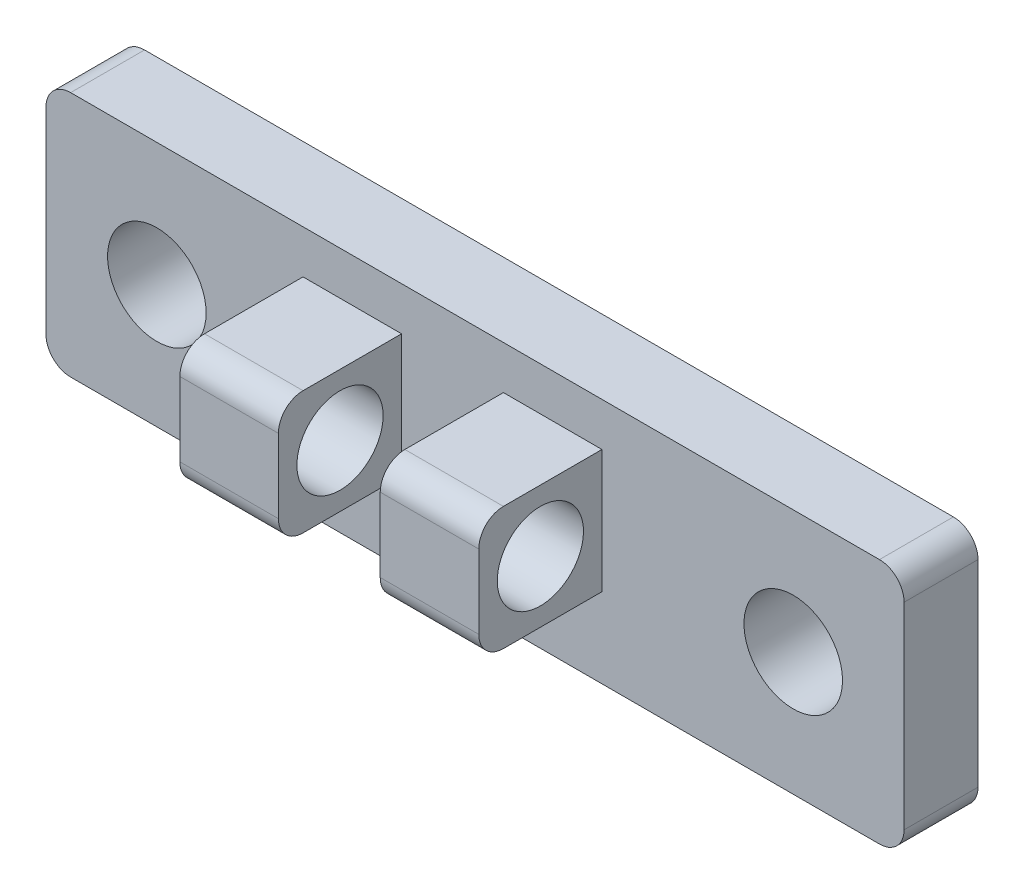
from build123d import *

# Parameters (mm, degrees)
BOSS_EXTRUDE1_DEPTH = 3
SKETCH2_W           = 4
SKETCH2_H           = 5
BOSS_EXTRUDE2_DEPTH = 5
SKETCH3_R           = 1.75
CUT_EXTRUDE1_DEPTH  = 14
FILLET1_R           = 1
SKETCH5_R           = 2
CUT_EXTRUDE2_DEPTH  = 5
SKETCH7_R           = 2
CUT_EXTRUDE3_DEPTH  = 5
FILLET2_R           = 1


with BuildPart() as part:
    # Sketch1 → Boss-Extrude1 (new body)
    with BuildSketch(Plane.XY):
        Polygon((17.84234206, -3.321281539), (17.84234206, -10.791281539), (17.84234206, -11.641281539), (16.99234206, -11.641281539), (-15.30765794, -11.641281539), (-16.98765794, -11.641281539), (-16.98765794, -9.505481629), (-16.98765794, -2.491281539), (-16.98765794, -1.641281539), (-16.13765794, -1.641281539), (16.16234206, -1.641281539), (17.84234206, -1.641281539), align=None)
    extrude(amount=BOSS_EXTRUDE1_DEPTH)

    # Sketch2 → Boss-Extrude2 (add)
    with BuildSketch(Plane.XY.offset(3)):
        with Locations((-4.554565942, -5.902432564)):
            Rectangle(SKETCH2_W, SKETCH2_H)
        with Locations((3.578766058, -5.902432564)):
            Rectangle(SKETCH2_W, SKETCH2_H)
    extrude(amount=BOSS_EXTRUDE2_DEPTH)

    # Sketch3 → Cut-Extrude1 (cut)
    with BuildSketch(Plane(origin=(5.578766058, 0, 0), x_dir=(0, 0, -1), z_dir=(1, 0, 0))):
        with Locations(Location((-5.5, -5.902432564, 0), (0, 0, 90))):
            Circle(SKETCH3_R)
    extrude(amount=-CUT_EXTRUDE1_DEPTH, mode=Mode.SUBTRACT)

    # Fillet1
    fillet1_edges = [part.edges().sort_by_distance(p)[0] for p in [
        (-16.98765794, -11.641281539, 1.5),
        (-16.98765794, -1.641281539, 1.5),
        (17.84234206, -1.641281539, 1.5),
        (17.84234206, -11.641281539, 1.5),
    ]]
    fillet(fillet1_edges, radius=FILLET1_R)

    # Sketch5 → Cut-Extrude2 (cut)
    with BuildSketch(Plane.XY.offset(3)):
        with Locations((-12.48765794, -6.641281539)):
            Circle(SKETCH5_R)
    extrude(amount=-CUT_EXTRUDE2_DEPTH, mode=Mode.SUBTRACT)

    # Sketch7 → Cut-Extrude3 (cut)
    with BuildSketch(Plane.XY.offset(3)):
        with Locations((13.34234206, -6.641281539)):
            Circle(SKETCH7_R)
    extrude(amount=-CUT_EXTRUDE3_DEPTH, mode=Mode.SUBTRACT)

    # Fillet2
    fillet2_edges = [part.edges().sort_by_distance(p)[0] for p in [
        (-4.554565942, -8.402432564, 8),
        (-4.554565942, -3.402432564, 8),
        (3.578766058, -3.402432564, 8),
        (3.578766058, -8.402432564, 8),
    ]]
    fillet(fillet2_edges, radius=FILLET2_R)


solid = part.part
